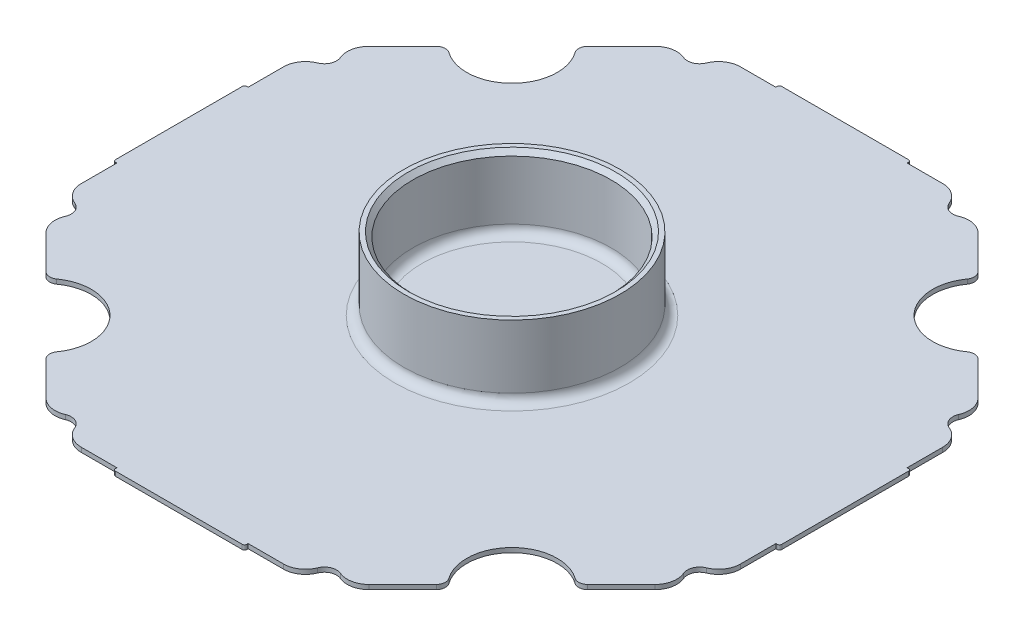
from build123d import *

# Parameters (mm, degrees)
BOSS_EXTRUDE1_DEPTH = 1
FILLET2_R           = 4.8
SKETCH5_W           = 29
SKETCH5_H           = 0.8
BOSS_EXTRUDE2_DEPTH = 1
CUT_EXTRUDE1_REACH  = 105.527
CIRPATTERN1_COUNT   = 4
SKETCH6_R           = 23.9
SKETCH6_R_2         = 21.9
BOSS_EXTRUDE3_DEPTH = 16
FILLET6_R           = 2
CHAMFER1_SIZE       = 1
FILLET5_R           = 2
FILLET7_R           = 0.5


with BuildPart() as part:
    # Sketch4 → Boss-Extrude1 (new body)
    with BuildSketch(Plane(origin=(0, 0, 0), x_dir=(1, 0, 0), z_dir=(0, 1, 0))):
        with BuildLine():
            Line((72.8, -27.525603906), (72.8, 27.525603906))
            ThreePointArc((72.8, 27.525603906), (68.286783321, 28.285311783), (70.940914849, 32.013832492))
            Line((70.940914849, 32.013832492), (32.013832492, 70.940914849))
            ThreePointArc((32.013832492, 70.940914849), (28.285311783, 68.286783321), (27.525603906, 72.8))
            Line((27.525603906, 72.8), (-27.525603906, 72.8))
            ThreePointArc((-27.525603906, 72.8), (-28.285311783, 68.286783321), (-32.013832492, 70.940914849))
            Line((-32.013832492, 70.940914849), (-70.940914849, 32.013832492))
            ThreePointArc((-70.940914849, 32.013832492), (-68.286783321, 28.285311783), (-72.8, 27.525603906))
            Line((-72.8, 27.525603906), (-72.8, -27.525603906))
            ThreePointArc((-72.8, -27.525603906), (-68.286783321, -28.285311783), (-70.940914849, -32.013832492))
            Line((-70.940914849, -32.013832492), (-32.013832492, -70.940914849))
            ThreePointArc((-32.013832492, -70.940914849), (-28.285311783, -68.286783321), (-27.525603906, -72.8))
            Line((-27.525603906, -72.8), (27.525603906, -72.8))
            ThreePointArc((27.525603906, -72.8), (28.285311783, -68.286783321), (32.013832492, -70.940914849))
            Line((32.013832492, -70.940914849), (70.940914849, -32.013832492))
            ThreePointArc((70.940914849, -32.013832492), (68.286783321, -28.285311783), (72.8, -27.525603906))
        make_face()
    extrude(amount=BOSS_EXTRUDE1_DEPTH)

    # Fillet2
    fillet2_edges = [part.edges().sort_by_distance(p)[0] for p in [
        (27.525603906, 0.5, 72.8),
        (-27.525603906, 0.5, 72.8),
        (-32.013832492, 0.5, 70.940914849),
        (-70.940914849, 0.5, 32.013832492),
        (-72.8, 0.5, 27.525603906),
        (-72.8, 0.5, -27.525603906),
        (-70.940914849, 0.5, -32.013832492),
        (-32.013832492, 0.5, -70.940914849),
        (-27.525603906, 0.5, -72.8),
        (27.525603906, 0.5, -72.8),
        (32.013832492, 0.5, -70.940914849),
        (70.940914849, 0.5, -32.013832492),
        (72.8, 0.5, -27.525603906),
        (72.8, 0.5, 27.525603906),
        (70.940914849, 0.5, 32.013832492),
        (32.013832492, 0.5, 70.940914849),
    ]]
    fillet(fillet2_edges, radius=FILLET2_R)

    # Sketch5 → Boss-Extrude2 (add)
    with BuildSketch(Plane(origin=(0, 1, 0), x_dir=(1, 0, 0), z_dir=(0, 1, 0))):
        with Locations((0, 73.2)):
            Rectangle(SKETCH5_W, SKETCH5_H)
    boss_extrude2 = extrude(amount=-BOSS_EXTRUDE2_DEPTH)

    # Sketch7 → Cut-Extrude1 (cut, up to next)
    with BuildSketch(Plane(origin=(0, 1, 0), x_dir=(1, 0, 0), z_dir=(0, 1, 0)), mode=Mode.PRIVATE) as cut_extrude1_sk1:
        with BuildLine():
            Line((58.548441482, 44.406305859), (44.406305859, 58.548441482))
            ThreePointArc((44.406305859, 58.548441482), (44.406305859, 44.406305859), (58.548441482, 44.406305859))
        make_face()
    cut_extrude1_tool1 = extrude(cut_extrude1_sk1.sketch, amount=-CUT_EXTRUDE1_REACH, mode=Mode.PRIVATE) & part.part
    cut_extrude1 = cut_extrude1_tool1.solids().sort_by_distance((48.476319, 1, -48.476319))[0]
    add(cut_extrude1, mode=Mode.SUBTRACT)

    # CirPattern1: Boss-Extrude2, Cut-Extrude1 ×4 about axis
    cirpattern1_axis = Axis((0, 0, 0), (0, 1, 0))
    add([boss_extrude2.rotate(cirpattern1_axis, i * 360 / CIRPATTERN1_COUNT) for i in range(1, CIRPATTERN1_COUNT)])
    add([cut_extrude1.rotate(cirpattern1_axis, i * 360 / CIRPATTERN1_COUNT) for i in range(1, CIRPATTERN1_COUNT)], mode=Mode.SUBTRACT)

    # Sketch6 → Boss-Extrude3 (add)
    with BuildSketch(Plane(origin=(0, 1, 0), x_dir=(1, 0, 0), z_dir=(0, 1, 0))):
        with Locations(Location((0, 0, 0), (0, 0, 270))):
            Circle(SKETCH6_R)
        with Locations(Location((0, 0, 0), (0, 0, 270))):
            Circle(SKETCH6_R_2, mode=Mode.SUBTRACT)
    extrude(amount=BOSS_EXTRUDE3_DEPTH)

    # Fillet6
    fillet6_edges = [part.edges().sort_by_distance(p)[0] for p in [
        (58.548441482, 0.5, -44.406305859),
        (44.406305859, 0.5, -58.548441482),
        (44.406305859, 0.5, 58.548441482),
        (58.548441482, 0.5, 44.406305859),
        (-58.548441482, 0.5, 44.406305859),
        (-44.406305859, 0.5, 58.548441482),
        (-44.406305859, 0.5, -58.548441482),
        (-58.548441482, 0.5, -44.406305859),
    ]]
    fillet(fillet6_edges, radius=FILLET6_R)

    # Chamfer1
    chamfer1_edges = [part.edges().sort_by_distance(p)[0] for p in [
        (0, 17, -21.9),
    ]]
    chamfer(chamfer1_edges, length=CHAMFER1_SIZE)

    # Fillet5
    fillet5_edges = [part.edges().sort_by_distance(p)[0] for p in [
        (0, 1, -21.9),
        (0, 1, -23.9),
    ]]
    fillet(fillet5_edges, radius=FILLET5_R)

    # Fillet7
    fillet7_edges = [part.edges().sort_by_distance(p)[0] for p in [
        (-14.5, 0.5, -73.6),
        (14.5, 0.5, -73.6),
        (73.6, 0.5, -14.5),
        (73.6, 0.5, 14.5),
        (14.5, 0.5, 73.6),
        (-14.5, 0.5, 73.6),
        (-73.6, 0.5, 14.5),
        (-73.6, 0.5, -14.5),
    ]]
    fillet(fillet7_edges, radius=FILLET7_R)


solid = part.part
